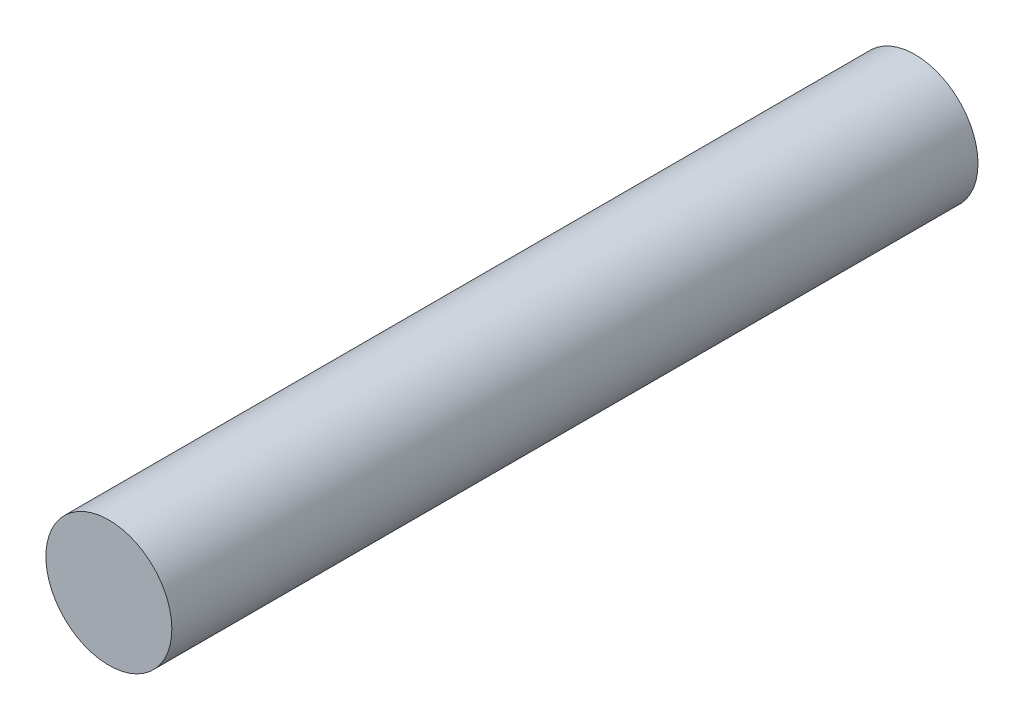
from build123d import *

# Parameters (mm, degrees)
ESQUISSE1_R        = 2.5
BOSS_EXTRU_1_DEPTH = 16


with BuildPart() as part:
    # Esquisse1 → Boss.-Extru.1 (new, symmetric)
    with BuildSketch(Plane.XY):
        Circle(ESQUISSE1_R)
    extrude(amount=BOSS_EXTRU_1_DEPTH, both=True)


solid = part.part
